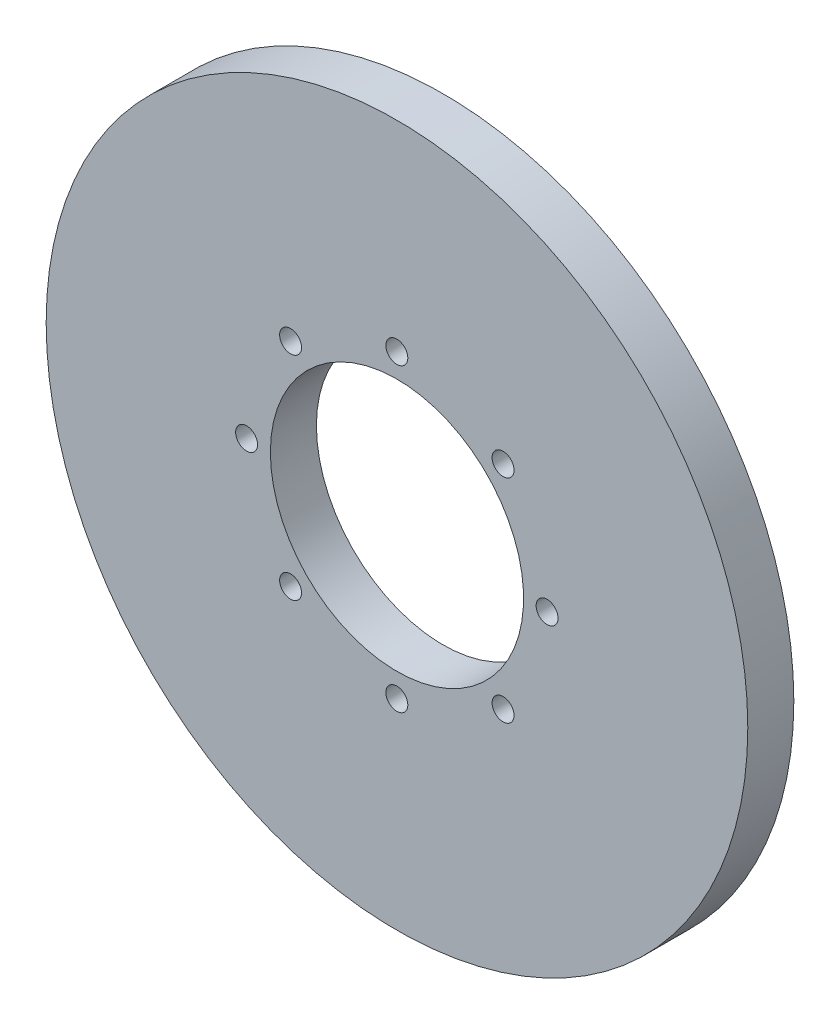
from build123d import *

# Parameters (mm, degrees)
SKETCH1_R                    = 152.4
BOSS_EXTRUDE1_DEPTH          = 20
F_3_8_0_375_DIAMETER_HOLE1_D = 9.525
CIRPATTERN1_COUNT            = 8
SKETCH5_R                    = 55
CUT_EXTRUDE1_DEPTH           = 217.452119417


with BuildPart() as part:
    # Sketch1 → Boss-Extrude1 (new body)
    with BuildSketch(Plane.XY):
        Circle(SKETCH1_R)
    extrude(amount=BOSS_EXTRUDE1_DEPTH)

    # 3/8 (0.375) Diameter Hole1 (through all)
    with Locations(Plane(origin=(0, 0, 0), x_dir=(-1, 0, 0), z_dir=(0, 0, -1))):
        with Locations((-65.2, 0)):
            f_3_8_0_375_diameter_hole1 = Hole(F_3_8_0_375_DIAMETER_HOLE1_D / 2)

    # CirPattern1: 3/8 (0.375) Diameter Hole1 ×8 about axis
    cirpattern1_axis = Axis((-0.063734115, 0, 0), (0, 0, 1))
    for i in range(1, CIRPATTERN1_COUNT):
        add(f_3_8_0_375_diameter_hole1.rotate(cirpattern1_axis, i * 360 / CIRPATTERN1_COUNT), mode=Mode.SUBTRACT)

    # Sketch5 → Cut-Extrude1 (cut, through all)
    with BuildSketch(Plane(origin=(0, 0, 0), x_dir=(-1, 0, 0), z_dir=(0, 0, -1))):
        Circle(SKETCH5_R)
    extrude(amount=-CUT_EXTRUDE1_DEPTH, mode=Mode.SUBTRACT)


solid = part.part
